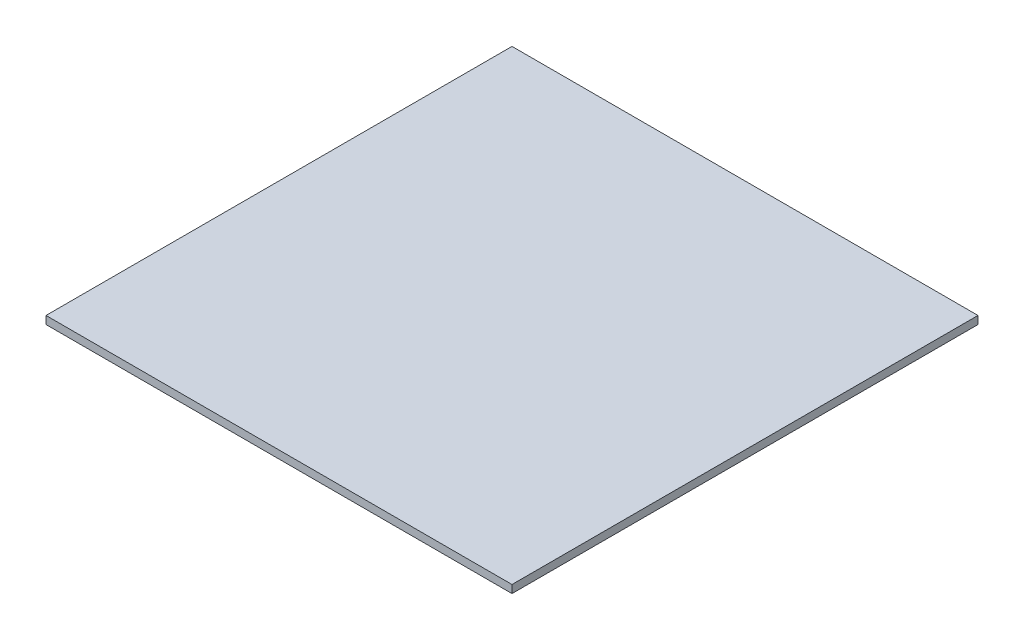
from build123d import *

# Parameters (mm, degrees)
CROQUIS2_W              = 1500
CROQUIS2_H              = 1500
SALIENTE_EXTRUIR1_DEPTH = 25.4


with BuildPart() as part:
    # Croquis2 → Saliente-Extruir1 (new body)
    with BuildSketch(Plane(origin=(0, 0, 0), x_dir=(1, 0, 0), z_dir=(0, 1, 0))):
        Rectangle(CROQUIS2_W, CROQUIS2_H)
    extrude(amount=SALIENTE_EXTRUIR1_DEPTH)


solid = part.part
